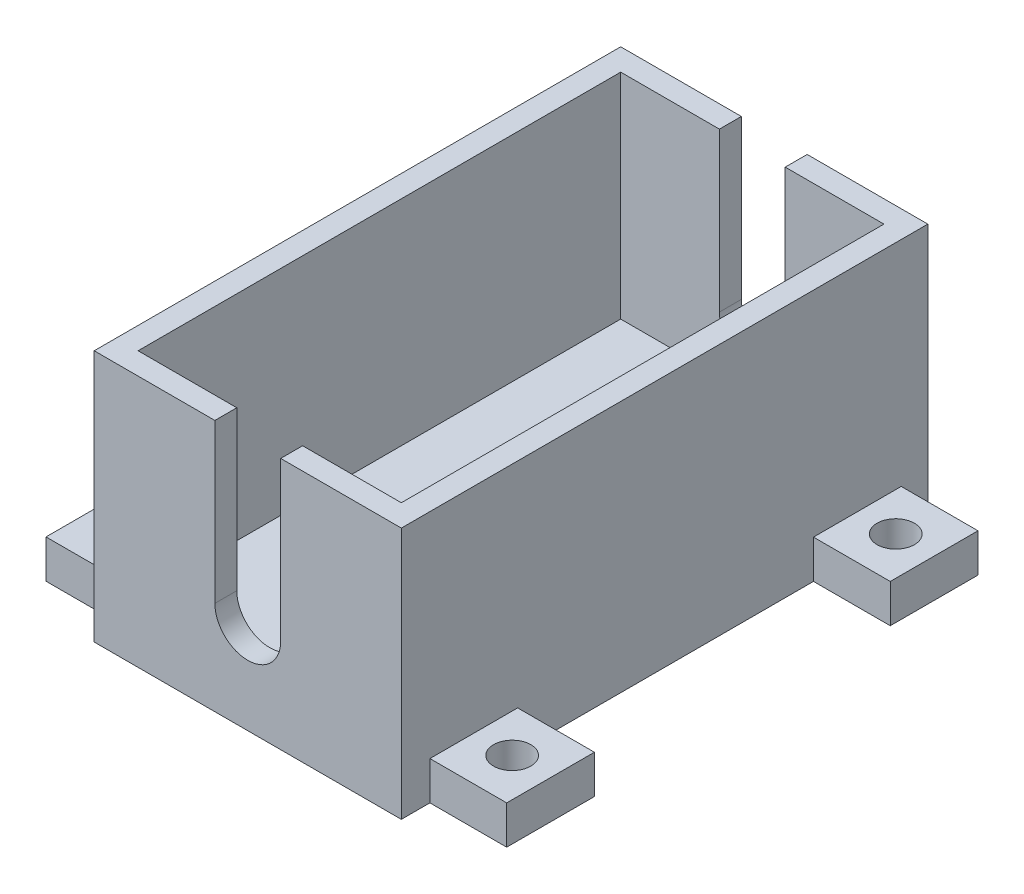
from build123d import *

# Parameters (mm, degrees)
SKETCH1_W           = 28
SKETCH1_H           = 48
BOSS_EXTRUDE1_DEPTH = 23
SKETCH3_W           = 24
SKETCH3_H           = 44
CUT_EXTRUDE1_DEPTH  = 19.5
SKETCH4_W           = 7
SKETCH4_H           = 8
BOSS_EXTRUDE2_DEPTH = 3.5
SKETCH5_R           = 1.7
CUT_EXTRUDE5_DEPTH  = 3.5
CUT_EXTRUDE7_DEPTH  = 50


with BuildPart() as part:
    # Sketch1 → Boss-Extrude1 (new body)
    with BuildSketch(Plane(origin=(0, 0, 0), x_dir=(1, 0, 0), z_dir=(0, 1, 0))):
        Rectangle(SKETCH1_W, SKETCH1_H)
    extrude(amount=BOSS_EXTRUDE1_DEPTH)

    # Sketch3 → Cut-Extrude1 (cut)
    with BuildSketch(Plane(origin=(0, 23, 0), x_dir=(1, 0, 0), z_dir=(0, 1, 0))):
        Rectangle(SKETCH3_W, SKETCH3_H)
    extrude(amount=-CUT_EXTRUDE1_DEPTH, mode=Mode.SUBTRACT)

    # Sketch4 → Boss-Extrude2 (add)
    with BuildSketch(Plane.XZ):
        with Locations((17.5, 17.395203427)):
            Rectangle(SKETCH4_W, SKETCH4_H)
        with Locations((17.5, -17.574178575)):
            Rectangle(SKETCH4_W, SKETCH4_H)
        with Locations((-17.5, -17.574178575)):
            Rectangle(SKETCH4_W, SKETCH4_H)
        with Locations((-17.5, 17.395203427)):
            Rectangle(SKETCH4_W, SKETCH4_H)
    extrude(amount=-BOSS_EXTRUDE2_DEPTH)

    # Sketch5 → Cut-Extrude5 (cut)
    with BuildSketch(Plane.XZ):
        with Locations(Location((-17.5, 17.395203427, 0), (0, 0, 270))):
            Circle(SKETCH5_R)
        with Locations(Location((-17.5, -17.574178575, 0), (0, 0, 270))):
            Circle(SKETCH5_R)
        with Locations(Location((17.5, -17.574178575, 0), (0, 0, 270))):
            Circle(SKETCH5_R)
        with Locations(Location((17.5, 17.395203427, 0), (0, 0, 270))):
            Circle(SKETCH5_R)
    extrude(amount=-CUT_EXTRUDE5_DEPTH, mode=Mode.SUBTRACT)

    # Sketch7 → Cut-Extrude7 (cut)
    with BuildSketch(Plane.XY.offset(24)):
        with BuildLine():
            Line((3, 25.962103345), (3, 8.556782005))
            ThreePointArc((3, 8.556782005), (0, 5.556782005), (-3, 8.556782005))
            Line((-3, 8.556782005), (-3, 25.962103345))
            ThreePointArc((-3, 25.962103345), (0, 28.962103345), (3, 25.962103345))
        make_face()
    extrude(amount=-CUT_EXTRUDE7_DEPTH, mode=Mode.SUBTRACT)


solid = part.part
